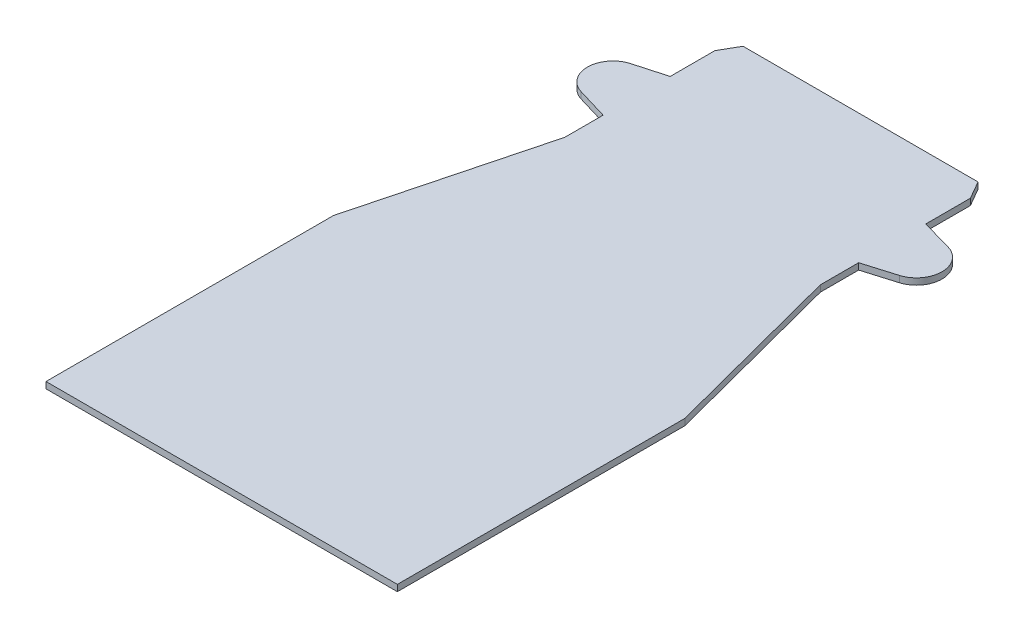
from build123d import *

# Parameters (mm, degrees)
EXTRUDE_1_DEPTH     = 1
SKETCH_2_W          = 89.659893576
SKETCH_2_H          = 2
CUT_EXTRUDE_1_DEPTH = 10


with BuildPart() as part:
    # 草图1 → 凸台-拉伸1 (new, symmetric)
    with BuildSketch(Plane(origin=(0, 0, 0), x_dir=(1, 0, 0), z_dir=(0, 1, 0))):
        with BuildLine():
            Line((55, 0), (-55, 0))
            Line((-55, 0), (-55, 90))
            Line((-55, 90), (-40, 147.411542732))
            Line((-40, 147.411542732), (-40, 159.411542732))
            Line((-40, 159.411542732), (-49.788880489, 162.334425912))
            ThreePointArc((-49.788880489, 162.334425912), (-55.499718249, 170.067141222), (-49.659893575, 177.70291242))
            Line((-49.659893575, 177.70291242), (-40, 180.411542732))
            Line((-40, 180.411542732), (-40, 194.411542732))
            Line((-40, 194.411542732), (-31, 210))
            Line((-31, 210), (31, 210))
            Line((31, 210), (40, 194.411542732))
            Line((40, 194.411542732), (40, 180.411542732))
            Line((40, 180.411542732), (49.659893575, 177.70291242))
            ThreePointArc((49.659893575, 177.70291242), (55.499718249, 170.067141222), (49.788880489, 162.334425912))
            Line((49.788880489, 162.334425912), (40, 159.411542732))
            Line((40, 159.411542732), (40, 147.411542732))
            Line((40, 147.411542732), (55, 90))
            Line((55, 90), (55, 0))
        make_face()
    extrude(amount=EXTRUDE_1_DEPTH, both=True)

    # 草图2 → 切除-拉伸1 (cut)
    with BuildSketch(Plane(origin=(0, 0, -210), x_dir=(-1, 0, 0), z_dir=(0, 0, -1))):
        Rectangle(SKETCH_2_W, SKETCH_2_H)
    extrude(amount=-CUT_EXTRUDE_1_DEPTH, mode=Mode.SUBTRACT)


solid = part.part
